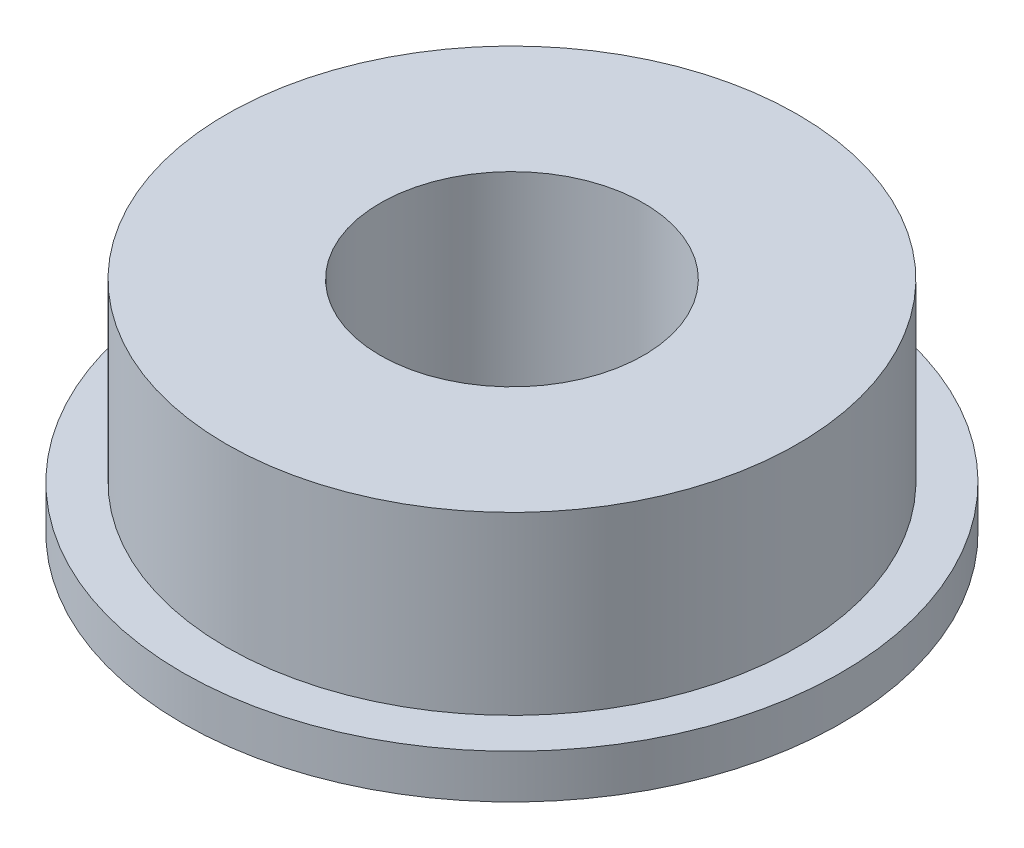
from build123d import *


with BuildPart() as part:
    # 草图1 → 旋转1 (revolve)
    with BuildSketch(Plane.XY, mode=Mode.PRIVATE) as revolve_1_sk:
        Polygon((-3, 0.4625), (-7.5, 0.4625), (-7.5, 1.4625), (-6.5, 1.4625), (-6.5, 5.4625), (-3, 5.4625), align=None)
    revolve(revolve_1_sk.sketch.rotate(Axis((0, 11.1375, 0), (0, -1, 0)), 270), axis=Axis((0, 11.1375, 0), (0, -1, 0)))


solid = part.part
